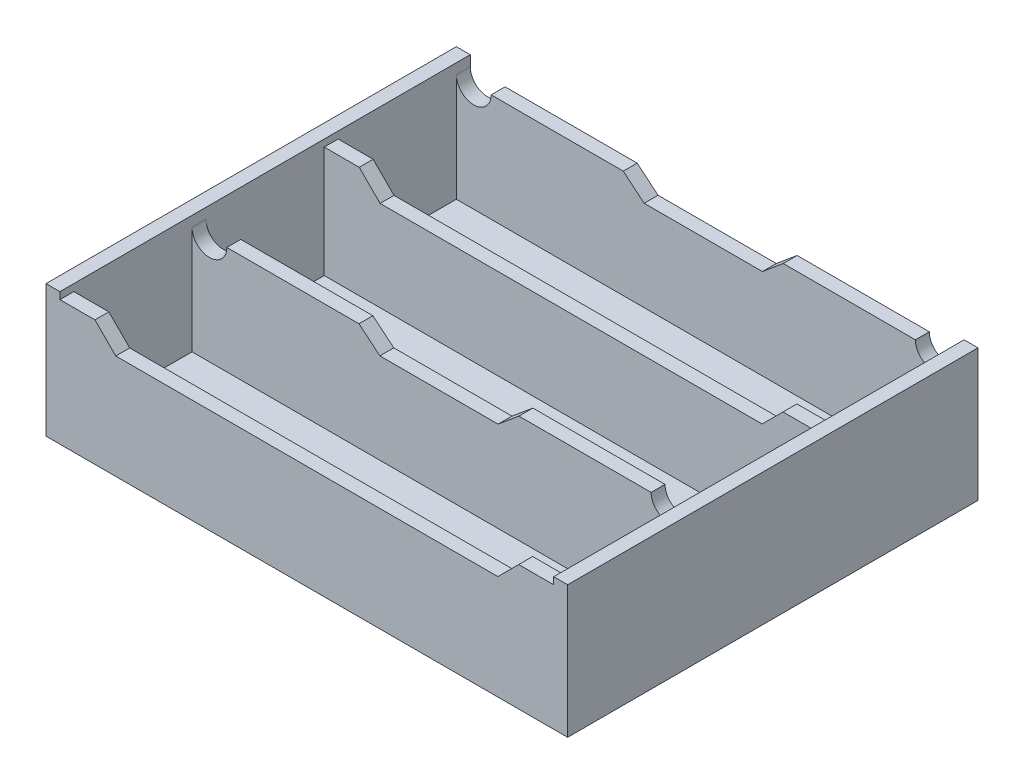
from build123d import *

# Parameters (mm, degrees)
SKETCH1_W            = 75
SKETCH1_H            = 40
BOSS_EXTRUDE1_DEPTH  = 2
SKETCH2_W            = 75
SKETCH2_H            = 40
SKETCH2_W_2          = 71
SKETCH2_H_2          = 17
BOSS_EXTRUDE2_DEPTH  = 17
CUT_EXTRUDE2_DEPTH   = 17
CUT_EXTRUDE3_REACH   = 82.169
CUT_EXTRUDE4_REACH   = 88.683
SKETCH5_R            = 1.6
MIRROR2_COPY_1_DEPTH = 17
SKETCH7_W            = 80.259890461
SKETCH7_H            = 23.370696072
CUT_EXTRUDE5_DEPTH   = 19


with BuildPart() as part:
    # Sketch1 → Boss-Extrude1 (new body)
    with BuildSketch(Plane(origin=(0, 0, 0), x_dir=(1, 0, 0), z_dir=(0, 1, 0))):
        with Locations((37.5, 20)):
            Rectangle(SKETCH1_W, SKETCH1_H)
    boss_extrude1 = extrude(amount=BOSS_EXTRUDE1_DEPTH)

    # Sketch2 → Boss-Extrude2 (add)
    with BuildSketch(Plane(origin=(0, 2, 0), x_dir=(1, 0, 0), z_dir=(0, 1, 0))):
        with Locations((37.5, 20)):
            Rectangle(SKETCH2_W, SKETCH2_H)
        with Locations((37.5, 29.5)):
            Rectangle(SKETCH2_W_2, SKETCH2_H_2, mode=Mode.SUBTRACT)
        with Locations((37.5, 10.5)):
            Rectangle(SKETCH2_W_2, SKETCH2_H_2, mode=Mode.SUBTRACT)
    boss_extrude2 = extrude(amount=BOSS_EXTRUDE2_DEPTH)

    # Sketch3 → Cut-Extrude2 (cut)
    with BuildSketch(Plane.XY):
        with BuildLine():
            Line((2, 17.5), (2, 19))
            Line((2, 19), (73, 19))
            Line((73, 19), (73, 17.5))
            ThreePointArc((73, 17.5), (70.5, 15), (68, 17.5))
            Line((68, 17.5), (49, 17.5))
            Line((49, 17.5), (46, 15))
            Line((46, 15), (29, 15))
            Line((29, 15), (26, 17.5))
            Line((26, 17.5), (7, 17.5))
            ThreePointArc((7, 17.5), (4.5, 15), (2, 17.5))
        make_face()
    cut_extrude2 = extrude(amount=-CUT_EXTRUDE2_DEPTH, mode=Mode.SUBTRACT)

    # Mirror1: Cut-Extrude2 across plane
    add(cut_extrude2.mirror(Plane.XY.offset(-20)), mode=Mode.SUBTRACT)

    # Sketch4 → Cut-Extrude3 (cut, up to next)
    with BuildSketch(Plane.XY.offset(-19), mode=Mode.PRIVATE) as cut_extrude3_sk1:
        Polygon((2, 18), (7.035918341, 18), (10.035918341, 15), (64.964081659, 15), (67.964081659, 18), (73, 18), (73, 19), (2, 19), align=None)
    cut_extrude3_tool1 = extrude(cut_extrude3_sk1.sketch, amount=-CUT_EXTRUDE3_REACH, mode=Mode.PRIVATE) & part.part
    cut_extrude3 = cut_extrude3_tool1.solids().sort_by_distance((37.5, 17.098486, -19))[0]
    add(cut_extrude3, mode=Mode.SUBTRACT)

    # Sketch5 → Cut-Extrude4 (cut, up to next)
    with BuildSketch(Plane(origin=(0, 2, 0), x_dir=(1, 0, 0), z_dir=(0, 1, 0)), mode=Mode.PRIVATE) as cut_extrude4_sk1:
        with Locations(Location((37.5, 29.5, 0), (0, 0, 270))):
            Circle(SKETCH5_R)
    cut_extrude4_tool1 = extrude(cut_extrude4_sk1.sketch, amount=-CUT_EXTRUDE4_REACH, mode=Mode.PRIVATE) & part.part
    # Sketch5 → Cut-Extrude4 (cut, up to next)
    with BuildSketch(Plane(origin=(0, 2, 0), x_dir=(1, 0, 0), z_dir=(0, 1, 0)), mode=Mode.PRIVATE) as cut_extrude4_sk2:
        with Locations(Location((37.5, 10.5, 0), (0, 0, 270))):
            Circle(SKETCH5_R)
    cut_extrude4_tool2 = extrude(cut_extrude4_sk2.sketch, amount=-CUT_EXTRUDE4_REACH, mode=Mode.PRIVATE) & part.part
    cut_extrude4_1 = cut_extrude4_tool1.solids().sort_by_distance((37.5, 2, -29.5))[0]
    add(cut_extrude4_1, mode=Mode.SUBTRACT)
    cut_extrude4_2 = cut_extrude4_tool2.solids().sort_by_distance((37.5, 2, -10.5))[0]
    add(cut_extrude4_2, mode=Mode.SUBTRACT)
    cut_extrude4 = cut_extrude4_1 + cut_extrude4_2  # Cut-Extrude4 as one shape, for the pattern or mirror that repeats it

    # Mirror2: Boss-Extrude1, Boss-Extrude2, Cut-Extrude2, Cut-Extrude3, Cut-Extrude4 across plane
    add(boss_extrude1.mirror(Plane.XY.offset(-1)))
    add(boss_extrude2.mirror(Plane.XY.offset(-1)))
    add(cut_extrude2.mirror(Plane.XY.offset(-1)), mode=Mode.SUBTRACT)
    add(cut_extrude3.mirror(Plane.XY.offset(-1)), mode=Mode.SUBTRACT)
    add(cut_extrude4.mirror(Plane.XY.offset(-1)), mode=Mode.SUBTRACT)

    # Mirror2 copy 1 sketch → Mirror2 copy 1 (cut)
    with BuildSketch(Plane.XY.offset(38)):
        with BuildLine():
            Line((2, 17.5), (2, 19))
            Line((2, 19), (73, 19))
            Line((73, 19), (73, 17.5))
            ThreePointArc((73, 17.5), (70.5, 15), (68, 17.5))
            Line((68, 17.5), (49, 17.5))
            Line((49, 17.5), (46, 15))
            Line((46, 15), (29, 15))
            Line((29, 15), (26, 17.5))
            Line((26, 17.5), (7, 17.5))
            ThreePointArc((7, 17.5), (4.5, 15), (2, 17.5))
        make_face()
    extrude(amount=-MIRROR2_COPY_1_DEPTH, mode=Mode.SUBTRACT)

    # Sketch7 → Cut-Extrude5 (cut)
    with BuildSketch(Plane.XY.offset(38)):
        with Locations((37.807509159, 10.038141028)):
            Rectangle(SKETCH7_W, SKETCH7_H)
    extrude(amount=-CUT_EXTRUDE5_DEPTH, mode=Mode.SUBTRACT)


solid = part.part
